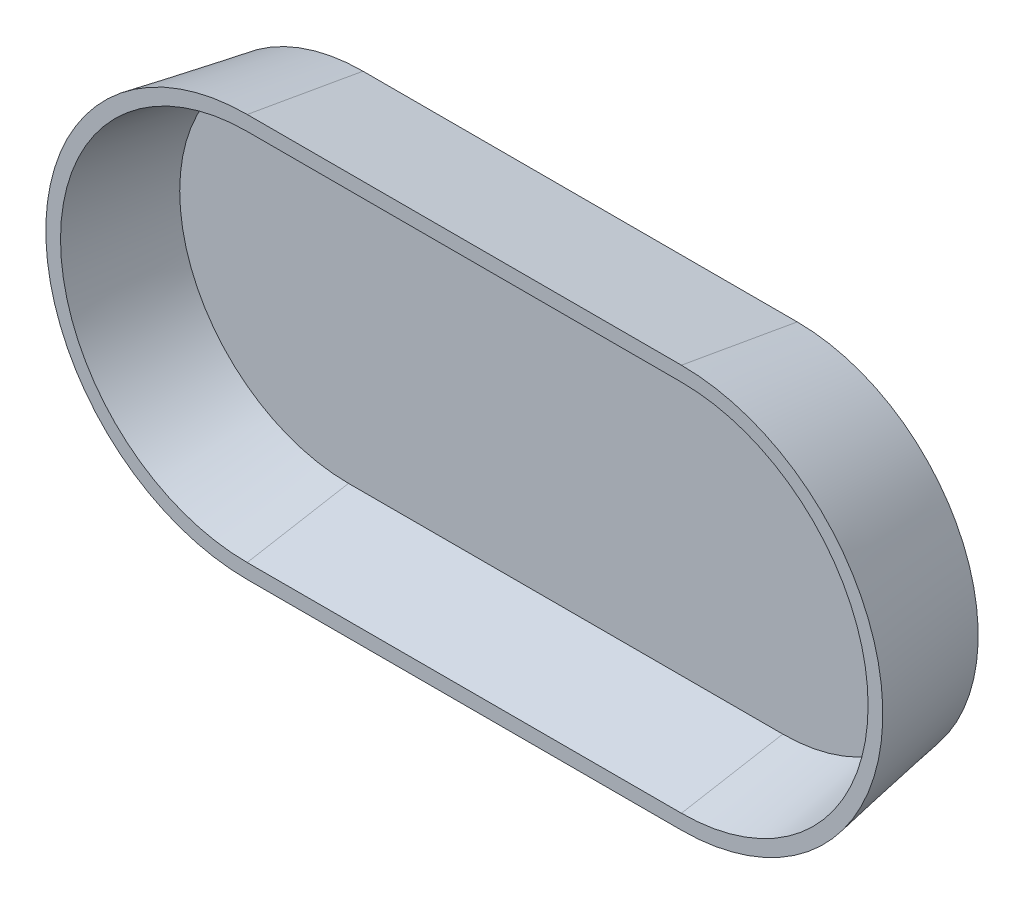
from build123d import *

# Parameters (mm, degrees)
BOSS_EXTRUDE1_DEPTH = 8
BOSS_EXTRUDE1_DRAFT = -10
SHELL1_T            = -1


with BuildPart() as part:
    # Sketch1 → Boss-Extrude1 (with draft: the straight prism first)
    with BuildSketch(Plane.XY):
        with BuildLine():
            ThreePointArc((0, -12.5), (12.5, 0), (0, 12.5))
            Line((0, 12.5), (-30, 12.5))
            ThreePointArc((-30, 12.5), (-42.5, 0), (-30, -12.5))
            Line((-30, -12.5), (0, -12.5))
        make_face()
    extrude(amount=BOSS_EXTRUDE1_DEPTH)
    # Boss-Extrude1: the draft: its side faces are tilted about the plane it starts from
    boss_extrude1_sides = [part.faces().sort_by_distance(p)[0] for p in [
        (-15, -12.5, 4),
        (12.5, 0, 4),
        (-15, 12.5, 4),
        (-42.5, 0, 4),
    ]]
    draft(boss_extrude1_sides, Plane.XY, BOSS_EXTRUDE1_DRAFT)

    # Shell1
    shell1_openings = [part.faces().sort_by_distance(p)[0] for p in [
        (-15, 0, 8),
    ]]
    offset(amount=SHELL1_T, openings=shell1_openings, kind=Kind.INTERSECTION)


solid = part.part
